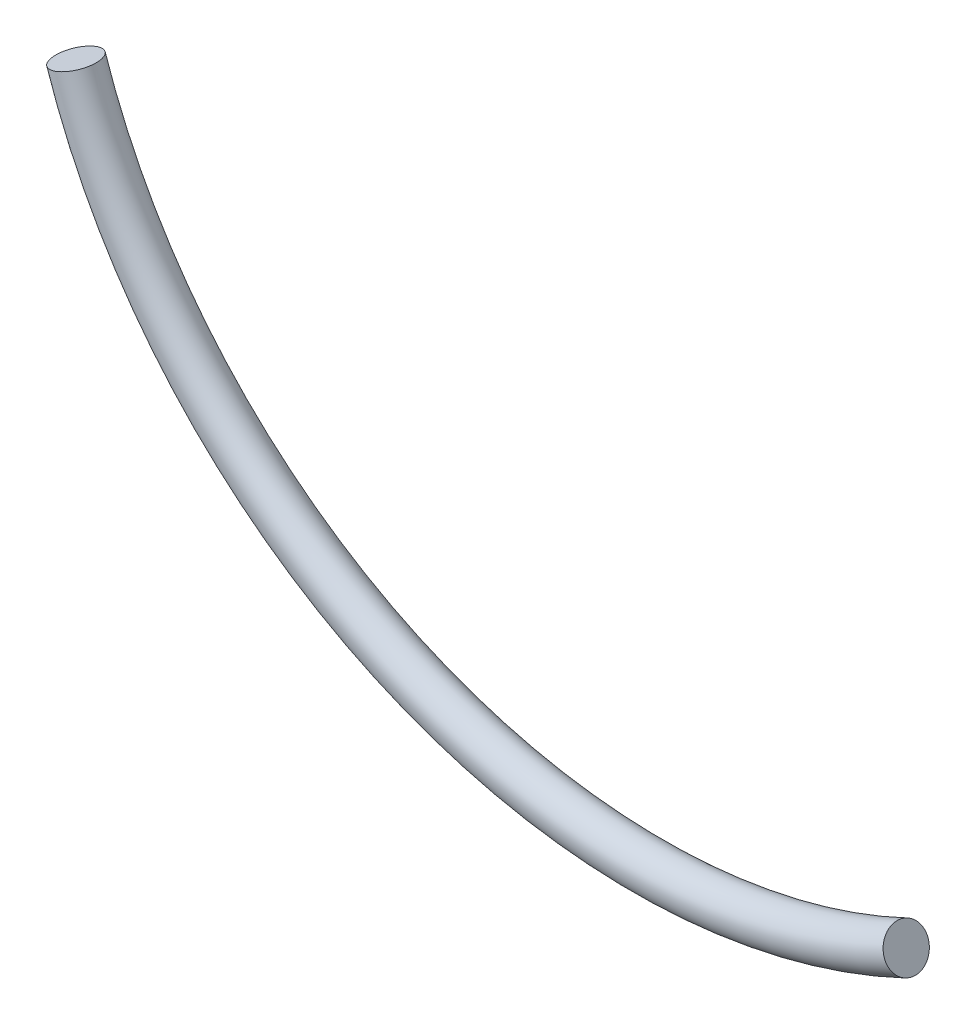
from build123d import *

# Parameters (mm, degrees)
SKETCH2_R = 50.8


with BuildPart() as part:
    # Sweep1: sweep along a path in Sketch1
    with BuildLine(Plane.XY) as sweep1_path:
        ThreePointArc((1640.104793271, -2343.34912911), (2441.015276157, -3214.156240077), (3623.908161215, -3191.198701302))
    # Sketch2 → Sweep1 (sweep)
    with BuildSketch(Plane(origin=(1640.104793271, -2343.34912911, 0), x_dir=(0.9491359897649313, 0.31486643665679, 0), z_dir=(0.31486643665679, -0.9491359897649313, 0))):
        Circle(SKETCH2_R)
    sweep(path=sweep1_path.line)


solid = part.part
